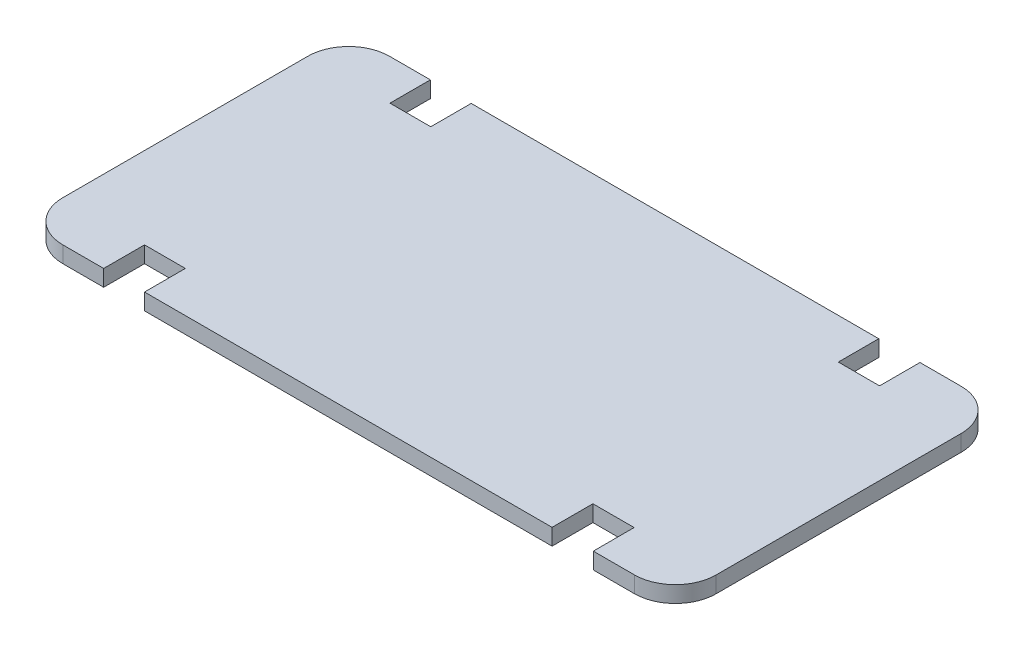
from build123d import *

# Parameters (mm, degrees)
BOSS_EXTRUDE1_DEPTH = 5.08
SKETCH3_W           = 12.7
SKETCH3_H           = 12.7
SKETCH3_H_2         = 12.575411903
SKETCH3_W_2         = 12.822150439
CUT_EXTRUDE1_DEPTH  = 114.705788771


with BuildPart() as part:
    # Sketch2 → Boss-Extrude1 (new body)
    with BuildSketch(Plane(origin=(0, 0, 0), x_dir=(1, 0, 0), z_dir=(0, 1, 0))):
        with BuildLine():
            Line((-88.9, -50.8), (88.9, -50.8))
            ThreePointArc((88.9, -50.8), (97.880256121, -47.080256121), (101.6, -38.1))
            Line((101.6, -38.1), (101.6, 38.1))
            ThreePointArc((101.6, 38.1), (97.880256121, 47.080256121), (88.9, 50.8))
            Line((88.9, 50.8), (-88.9, 50.8))
            ThreePointArc((-88.9, 50.8), (-97.880256121, 47.080256121), (-101.6, 38.1))
            Line((-101.6, 38.1), (-101.6, -38.1))
            ThreePointArc((-101.6, -38.1), (-97.880256121, -47.080256121), (-88.9, -50.8))
        make_face()
    extrude(amount=BOSS_EXTRUDE1_DEPTH)

    # Sketch3 → Cut-Extrude1 (cut, through all)
    with BuildSketch(Plane(origin=(0, 5.08, 0), x_dir=(1, 0, 0), z_dir=(0, 1, 0))):
        with Locations((-69.838651623, -44.45)):
            Rectangle(SKETCH3_W, SKETCH3_H)
        with Locations((-69.838651623, 44.512294049)):
            Rectangle(SKETCH3_W, SKETCH3_H_2)
        with Locations((69.673417763, -44.45)):
            Rectangle(SKETCH3_W_2, SKETCH3_H)
        with Locations((69.673417763, 44.512294049)):
            Rectangle(SKETCH3_W_2, SKETCH3_H_2)
    extrude(amount=-CUT_EXTRUDE1_DEPTH, mode=Mode.SUBTRACT)


solid = part.part
